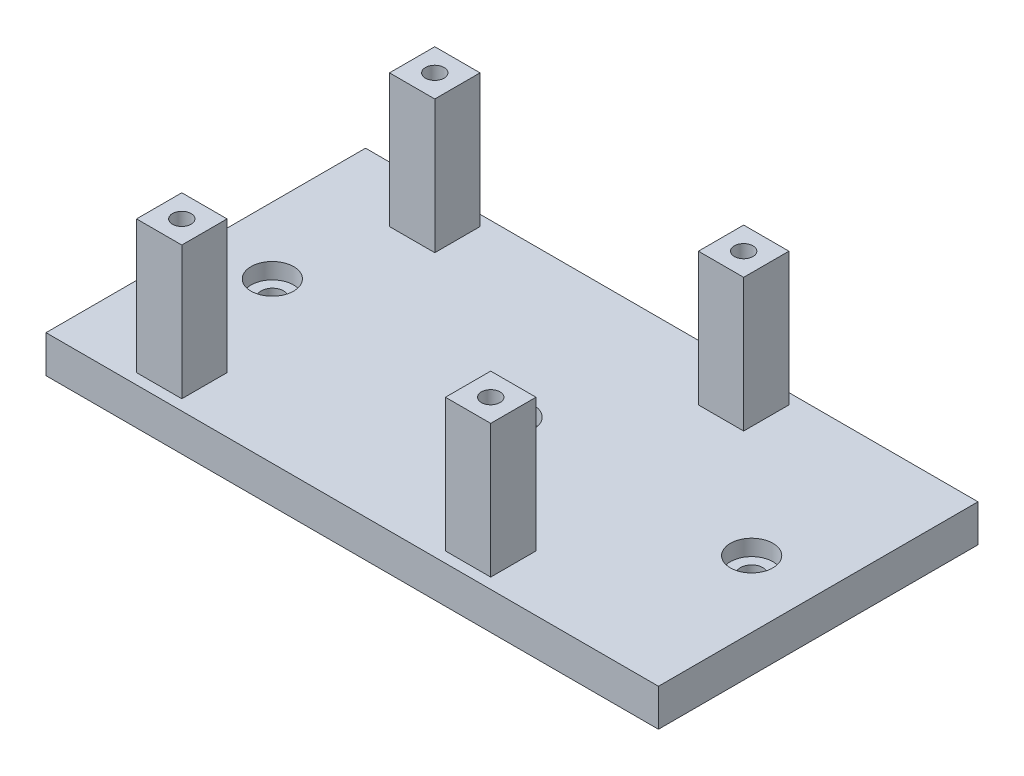
from build123d import *

# Parameters (mm, degrees)
SKETCH1_W           = 115
SKETCH1_H           = 60
SKETCH1_R           = 2.1
BOSS_EXTRUDE2_DEPTH = 7
SKETCH2_R           = 4
CUT_EXTRUDE1_DEPTH  = 3
SKETCH5_W           = 8.5
SKETCH5_H           = 8.5
BOSS_EXTRUDE3_DEPTH = 25
SKETCH6_R           = 1.75
CUT_EXTRUDE2_DEPTH  = 10


with BuildPart() as part:
    # Sketch1 → Boss-Extrude2 (new body)
    with BuildSketch(Plane(origin=(0, 0, 0), x_dir=(1, 0, 0), z_dir=(0, 1, 0))):
        with Locations((57.5, 30)):
            Rectangle(SKETCH1_W, SKETCH1_H)
        with Locations(Location((57.5, 30, 0), (0, 0, 270))):
            Circle(SKETCH1_R, mode=Mode.SUBTRACT)
        with Locations(Location((12.5, 30, 0), (0, 0, 270))):
            Circle(SKETCH1_R, mode=Mode.SUBTRACT)
        with Locations(Location((102.5, 30, 0), (0, 0, 90))):
            Circle(SKETCH1_R, mode=Mode.SUBTRACT)
    extrude(amount=BOSS_EXTRUDE2_DEPTH)

    # Sketch2 → Cut-Extrude1 (cut)
    with BuildSketch(Plane(origin=(0, 7, 0), x_dir=(1, 0, 0), z_dir=(0, 1, 0))):
        with Locations(Location((12.5, 30, 0), (0, 0, 270))):
            Circle(SKETCH2_R)
        with Locations(Location((57.5, 30, 0), (0, 0, 270))):
            Circle(SKETCH2_R)
        with Locations(Location((102.5, 30, 0), (0, 0, 270))):
            Circle(SKETCH2_R)
    extrude(amount=-CUT_EXTRUDE1_DEPTH, mode=Mode.SUBTRACT)

    # Sketch5 → Boss-Extrude3 (add)
    with BuildSketch(Plane(origin=(0, 7, 0), x_dir=(1, 0, 0), z_dir=(0, 1, 0))):
        with Locations((19.25, 53.75)):
            Rectangle(SKETCH5_W, SKETCH5_H)
        with Locations((19.25, 6.25)):
            Rectangle(SKETCH5_W, SKETCH5_H)
        Polygon((73, 58), (77.25, 58), (81.5, 58), (81.5, 49.5), (73, 49.5), align=None)
        Polygon((73, 10.5), (73, 2), (77.25, 2), (81.5, 2), (81.5, 10.5), align=None)
    extrude(amount=BOSS_EXTRUDE3_DEPTH)

    # Sketch6 → Cut-Extrude2 (cut)
    with BuildSketch(Plane(origin=(0, 32, 0), x_dir=(1, 0, 0), z_dir=(0, 1, 0))):
        with Locations(Location((19.25, 53.75, 0), (0, 0, 270))):
            Circle(SKETCH6_R)
        with Locations(Location((77.25, 53.75, 0), (0, 0, 270))):
            Circle(SKETCH6_R)
        with Locations(Location((19.25, 6.25, 0), (0, 0, 270))):
            Circle(SKETCH6_R)
        with Locations(Location((77.25, 6.25, 0), (0, 0, 270))):
            Circle(SKETCH6_R)
    extrude(amount=-CUT_EXTRUDE2_DEPTH, mode=Mode.SUBTRACT)


solid = part.part
